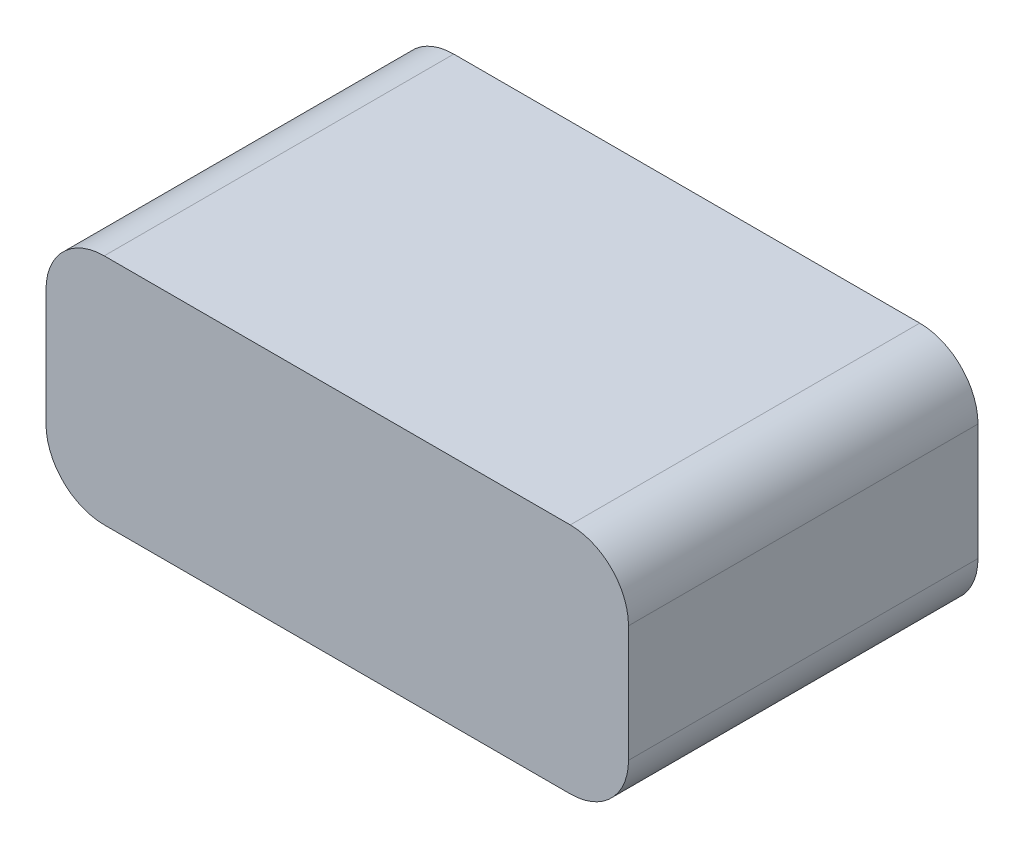
from build123d import *

# Parameters (mm, degrees)
SKETCH1_W           = 10
SKETCH1_H           = 4
BOSS_EXTRUDE1_DEPTH = 6
FILLET1_R           = 1


with BuildPart() as part:
    # Sketch1 → Boss-Extrude1 (new body)
    with BuildSketch(Plane.XY):
        Rectangle(SKETCH1_W, SKETCH1_H)
    extrude(amount=BOSS_EXTRUDE1_DEPTH)

    # Fillet1
    fillet1_edges = [part.edges().sort_by_distance(p)[0] for p in [
        (-5, 2, 3),
        (5, 2, 3),
        (5, -2, 3),
        (-5, -2, 3),
    ]]
    fillet(fillet1_edges, radius=FILLET1_R)


solid = part.part
